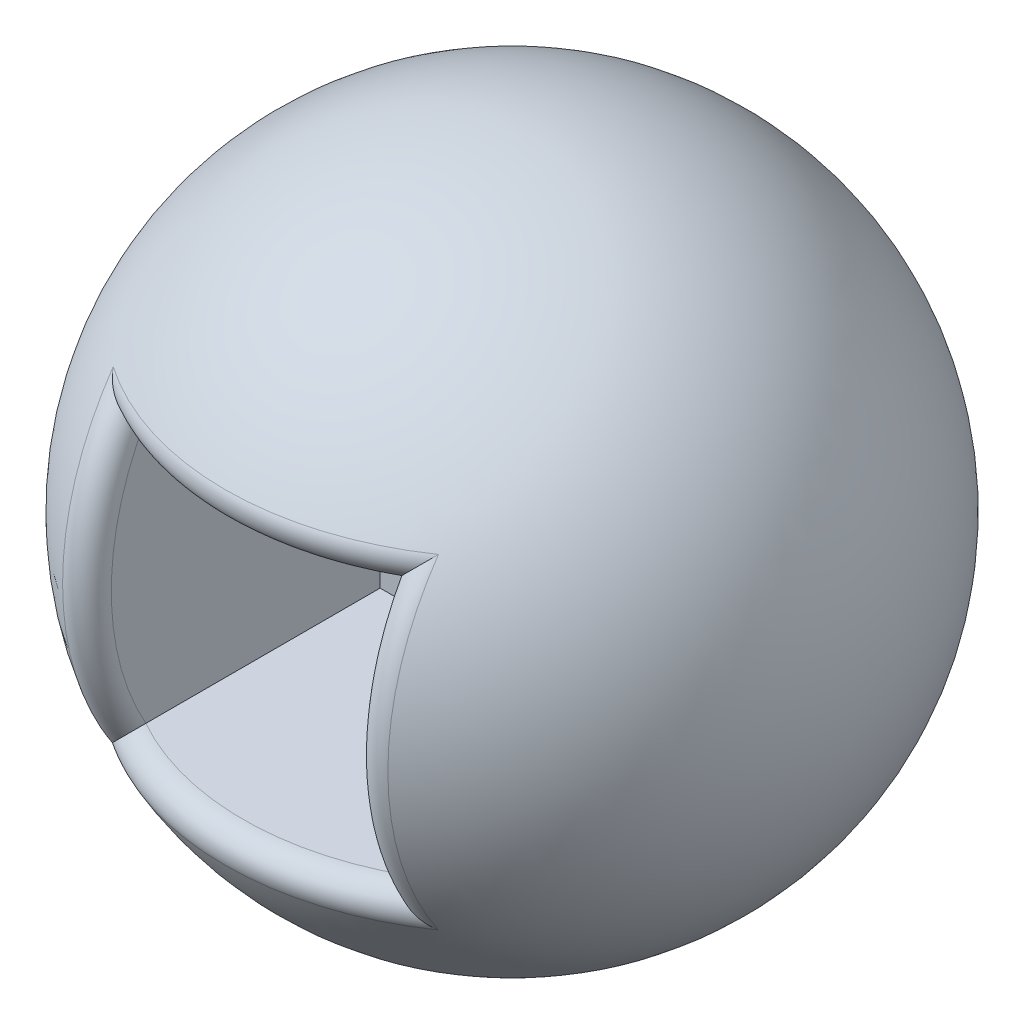
from build123d import *

# Parameters (mm, degrees)
SKETCH_2_W          = 6.4
SKETCH_2_H          = 6.4
CUT_EXTRUDE_1_DEPTH = 8
FILLET_1_R          = 0.5


with BuildPart() as part:
    # 스케치1 → 회전2 (revolve)
    with BuildSketch(Plane.XY):
        with BuildLine():
            Line((0, 8), (0, -8))
            ThreePointArc((0, -8), (8, 0), (0, 8))
        make_face()
    revolve(axis=Axis((0, 8, 0), (0, -1, 0)))

    # 스케치2 → 컷-돌출1 (cut)
    with BuildSketch(Plane.XY.offset(8)):
        Rectangle(SKETCH_2_W, SKETCH_2_H)
    extrude(amount=-CUT_EXTRUDE_1_DEPTH, mode=Mode.SUBTRACT)

    # 필렛1
    fillet_1_edges = [part.edges().sort_by_distance(p)[0] for p in [
        (0, -3.2, 7.332121112),
        (3.2, 0, 7.332121112),
        (0, 3.2, 7.332121112),
        (-3.2, 0, 7.332121112),
    ]]
    fillet(fillet_1_edges, radius=FILLET_1_R)


solid = part.part
